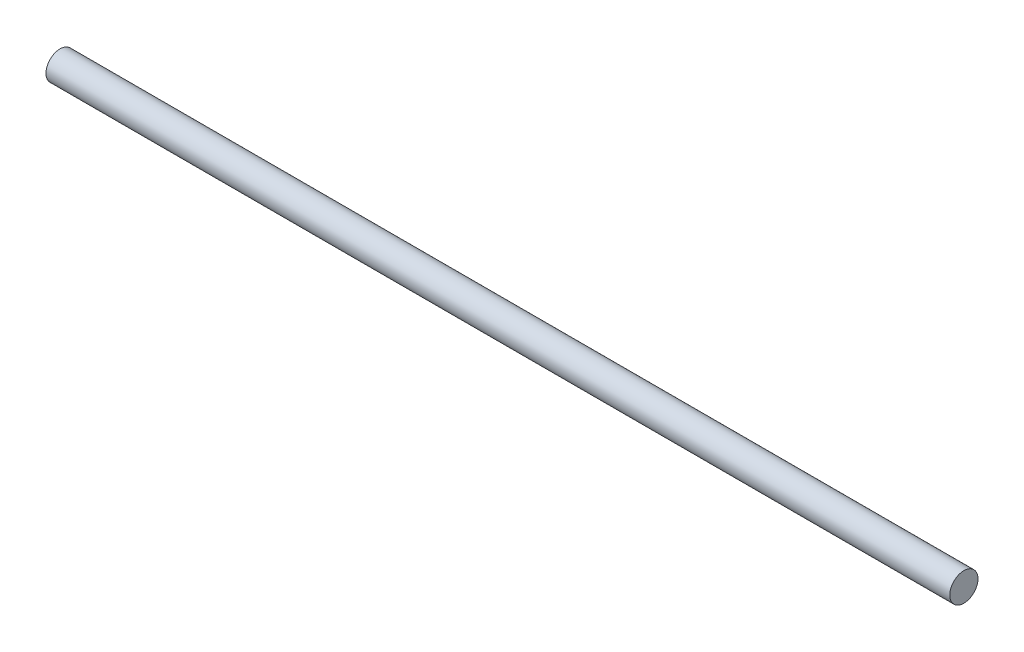
from build123d import *

# Parameters (mm, degrees)
SKETCH1_R           = 6.35
BOSS_EXTRUDE1_DEPTH = 406.4


with BuildPart() as part:
    # Sketch1 → Boss-Extrude1 (new body)
    with BuildSketch(Plane(origin=(0, 0, 0), x_dir=(0, 0, -1), z_dir=(1, 0, 0))):
        Circle(SKETCH1_R)
    extrude(amount=BOSS_EXTRUDE1_DEPTH)


solid = part.part
